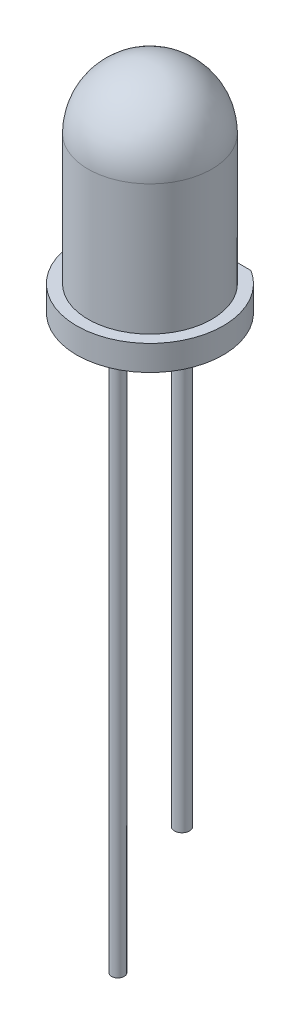
from build123d import *

# Parameters (mm, degrees)
CUT_EXTRUDE1_DEPTH = 10
SWEEP1_PROFILE_R   = 0.3
SWEEP2_PROFILE_R   = 0.25


with BuildPart() as part:
    # Sketch1 → Revolve1 (revolve)
    with BuildSketch(Plane(origin=(0, 0, 0), x_dir=(0, 0, -1), z_dir=(1, 0, 0))):
        with BuildLine():
            Line((0, 0), (0, 8.6))
            ThreePointArc((0, 8.6), (1.732411614, 7.882411614), (2.45, 6.15))
            Line((2.45, 6.15), (2.45, 1))
            Line((2.45, 1), (2.9, 1))
            Line((2.9, 1), (2.9, 0))
            Line((2.9, 0), (0, 0))
        make_face()
    revolve(axis=Axis((0, 0, 0), (0, 1, 0)))

    # Sketch2 → Cut-Extrude1 (cut)
    with BuildSketch(Plane(origin=(0, 1, 0), x_dir=(1, 0, 0), z_dir=(0, 1, 0))):
        Polygon((0, 2.45), (-2.000825275, 2.45), (-0.041843052, 4.408982223), (3.123853817, 2.45), align=None)
    extrude(amount=-CUT_EXTRUDE1_DEPTH, mode=Mode.SUBTRACT)

    # Sweep1: sweep along a path in Sketch3
    with BuildLine(Plane(origin=(0, 0, 0), x_dir=(0, 0, -1), z_dir=(1, 0, 0))) as sweep1_path:
        Line((1.27, 0), (1.27, -18.255708098))
    # Sweep1 profile (on start of the path) → Sweep1 (sweep)
    with BuildSketch(Plane(origin=(0, 0, -1.27), x_dir=(0, 0, -1), z_dir=(0, -1, 0))):
        Circle(SWEEP1_PROFILE_R)
    sweep(path=sweep1_path.line)

    # Sweep2: sweep along a path in Sketch3<3>
    with BuildLine(Plane(origin=(0, 0, 0), x_dir=(0, 0, -1), z_dir=(1, 0, 0))) as sweep2_path:
        Line((-1.27, 0), (-1.27, -22))
    # Sweep2 profile (on start of the path) → Sweep2 (sweep)
    with BuildSketch(Plane(origin=(0, 0, 1.27), x_dir=(0, 0, -1), z_dir=(0, -1, 0))):
        Circle(SWEEP2_PROFILE_R)
    sweep(path=sweep2_path.line)


solid = part.part
